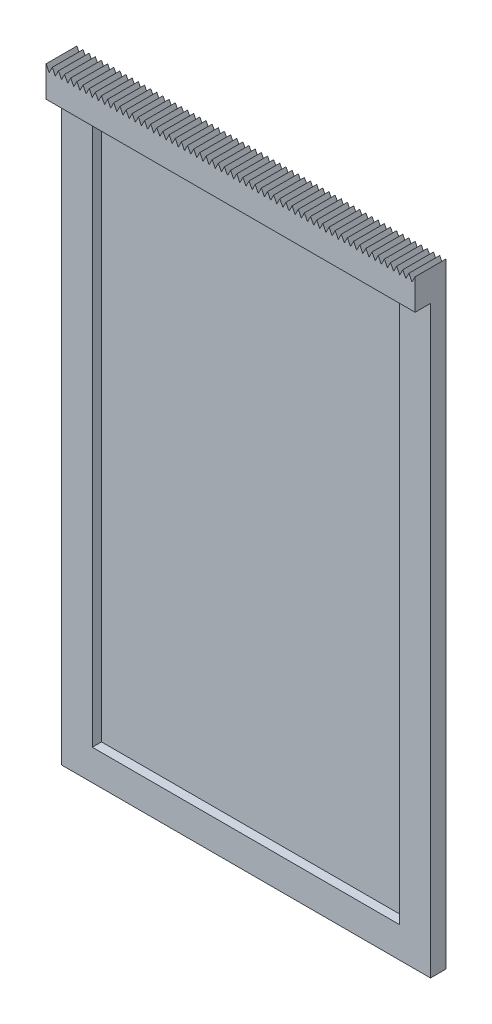
from build123d import *

# Parameters (mm, degrees)
CROQUIS2_W              = 120
CROQUIS2_H              = 200
SALIENTE_EXTRUIR1_DEPTH = 5
CROQUIS3_W              = 100
CROQUIS3_H              = 180
CORTAR_EXTRUIR1_DEPTH   = 3
CROQUIS4_W              = 120
CROQUIS4_H              = 10
SALIENTE_EXTRUIR3_DEPTH = 5
CORTAR_EXTRUIR2_DEPTH   = 10
CROQUIS6_W              = 5
CROQUIS6_H              = 10
SALIENTE_EXTRUIR4_DEPTH = 120
CORTAR_EXTRUIR3_DEPTH   = 10


with BuildPart() as part:
    # Croquis2 → Saliente-Extruir1 (new body)
    with BuildSketch(Plane.XY):
        Rectangle(CROQUIS2_W, CROQUIS2_H)
    extrude(amount=SALIENTE_EXTRUIR1_DEPTH)

    # Croquis3 → Cortar-Extruir1 (cut)
    with BuildSketch(Plane.XY.offset(5)):
        Rectangle(CROQUIS3_W, CROQUIS3_H)
    extrude(amount=-CORTAR_EXTRUIR1_DEPTH, mode=Mode.SUBTRACT)

    # Croquis4 → Saliente-Extruir3 (add)
    with BuildSketch(Plane.XY.offset(5)):
        with Locations((0, 95)):
            Rectangle(CROQUIS4_W, CROQUIS4_H)
    extrude(amount=SALIENTE_EXTRUIR3_DEPTH)

    # Croquis5 → Cortar-Extruir2 (cut)
    with BuildSketch(Plane(origin=(0, 100, 0), x_dir=(1, 0, 0), z_dir=(0, 1, 0))):
        Polygon((59, -8), (58, -10), (60, -10), align=None)
        Polygon((57, -8), (56, -10), (58, -10), align=None)
        Polygon((55, -8), (54, -10), (56, -10), align=None)
        Polygon((53, -8), (52, -10), (54, -10), align=None)
        Polygon((51, -8), (50, -10), (52, -10), align=None)
        Polygon((49, -8), (48, -10), (50, -10), align=None)
        Polygon((47, -8), (46, -10), (48, -10), align=None)
        Polygon((45, -8), (44, -10), (46, -10), align=None)
        Polygon((43, -8), (42, -10), (44, -10), align=None)
        Polygon((41, -8), (40, -10), (42, -10), align=None)
        Polygon((39, -8), (38, -10), (40, -10), align=None)
        Polygon((37, -8), (36, -10), (38, -10), align=None)
        Polygon((35, -8), (34, -10), (36, -10), align=None)
        Polygon((33, -8), (32, -10), (34, -10), align=None)
        Polygon((31, -8), (30, -10), (32, -10), align=None)
        Polygon((29, -8), (28, -10), (30, -10), align=None)
        Polygon((27, -8), (26, -10), (28, -10), align=None)
        Polygon((25, -8), (24, -10), (26, -10), align=None)
        Polygon((23, -8), (22, -10), (24, -10), align=None)
        Polygon((21, -8), (20, -10), (22, -10), align=None)
        Polygon((19, -8), (18, -10), (20, -10), align=None)
        Polygon((17, -8), (16, -10), (18, -10), align=None)
        Polygon((15, -8), (14, -10), (16, -10), align=None)
        Polygon((13, -8), (12, -10), (14, -10), align=None)
        Polygon((11, -8), (10, -10), (12, -10), align=None)
        Polygon((9, -8), (8, -10), (10, -10), align=None)
        Polygon((7, -8), (6, -10), (8, -10), align=None)
        Polygon((5, -8), (4, -10), (6, -10), align=None)
        Polygon((3, -8), (2, -10), (4, -10), align=None)
        Polygon((1, -8), (0, -10), (2, -10), align=None)
        Polygon((-1, -8), (-2, -10), (0, -10), align=None)
        Polygon((-3, -8), (-4, -10), (-2, -10), align=None)
        Polygon((-5, -8), (-6, -10), (-4, -10), align=None)
        Polygon((-7, -8), (-8, -10), (-6, -10), align=None)
        Polygon((-9, -8), (-10, -10), (-8, -10), align=None)
        Polygon((-11, -8), (-12, -10), (-10, -10), align=None)
        Polygon((-13, -8), (-14, -10), (-12, -10), align=None)
        Polygon((-15, -8), (-16, -10), (-14, -10), align=None)
        Polygon((-17, -8), (-18, -10), (-16, -10), align=None)
        Polygon((-19, -8), (-20, -10), (-18, -10), align=None)
        Polygon((-21, -8), (-22, -10), (-20, -10), align=None)
        Polygon((-23, -8), (-24, -10), (-22, -10), align=None)
        Polygon((-25, -8), (-26, -10), (-24, -10), align=None)
        Polygon((-27, -8), (-28, -10), (-26, -10), align=None)
        Polygon((-29, -8), (-30, -10), (-28, -10), align=None)
        Polygon((-31, -8), (-32, -10), (-30, -10), align=None)
        Polygon((-33, -8), (-34, -10), (-32, -10), align=None)
        Polygon((-35, -8), (-36, -10), (-34, -10), align=None)
        Polygon((-37, -8), (-38, -10), (-36, -10), align=None)
        Polygon((-39, -8), (-40, -10), (-38, -10), align=None)
        Polygon((-41, -8), (-42, -10), (-40, -10), align=None)
        Polygon((-43, -8), (-44, -10), (-42, -10), align=None)
        Polygon((-45, -8), (-46, -10), (-44, -10), align=None)
        Polygon((-47, -8), (-48, -10), (-46, -10), align=None)
        Polygon((-49, -8), (-50, -10), (-48, -10), align=None)
        Polygon((-51, -8), (-52, -10), (-50, -10), align=None)
        Polygon((-53, -8), (-54, -10), (-52, -10), align=None)
        Polygon((-55, -8), (-56, -10), (-54, -10), align=None)
        Polygon((-57, -8), (-58, -10), (-56, -10), align=None)
        Polygon((-59, -8), (-60, -10), (-58, -10), align=None)
    extrude(amount=-CORTAR_EXTRUIR2_DEPTH, mode=Mode.SUBTRACT)

    # Croquis6 → Saliente-Extruir4 (add)
    with BuildSketch(Plane.ZY.offset(60)):
        with Locations((7.5, 95)):
            Rectangle(CROQUIS6_W, CROQUIS6_H)
    extrude(amount=-SALIENTE_EXTRUIR4_DEPTH)

    # Croquis7 → Cortar-Extruir3 (cut)
    with BuildSketch(Plane.XY.offset(10)):
        Polygon((-58, 100), (-60, 100), (-59, 98), align=None)
        Polygon((60, 100), (58, 100), (59, 98), align=None)
        Polygon((58, 100), (56, 100), (57, 98), align=None)
        Polygon((56, 100), (54, 100), (55, 98), align=None)
        Polygon((54, 100), (52, 100), (53, 98), align=None)
        Polygon((52, 100), (50, 100), (51, 98), align=None)
        Polygon((50, 100), (48, 100), (49, 98), align=None)
        Polygon((48, 100), (46, 100), (47, 98), align=None)
        Polygon((46, 100), (44, 100), (45, 98), align=None)
        Polygon((44, 100), (42, 100), (43, 98), align=None)
        Polygon((42, 100), (40, 100), (41, 98), align=None)
        Polygon((40, 100), (38, 100), (39, 98), align=None)
        Polygon((38, 100), (36, 100), (37, 98), align=None)
        Polygon((36, 100), (34, 100), (35, 98), align=None)
        Polygon((34, 100), (32, 100), (33, 98), align=None)
        Polygon((32, 100), (30, 100), (31, 98), align=None)
        Polygon((30, 100), (28, 100), (29, 98), align=None)
        Polygon((28, 100), (26, 100), (27, 98), align=None)
        Polygon((26, 100), (24, 100), (25, 98), align=None)
        Polygon((24, 100), (22, 100), (23, 98), align=None)
        Polygon((22, 100), (20, 100), (21, 98), align=None)
        Polygon((20, 100), (18, 100), (19, 98), align=None)
        Polygon((18, 100), (16, 100), (17, 98), align=None)
        Polygon((16, 100), (14, 100), (15, 98), align=None)
        Polygon((14, 100), (12, 100), (13, 98), align=None)
        Polygon((12, 100), (10, 100), (11, 98), align=None)
        Polygon((10, 100), (8, 100), (9, 98), align=None)
        Polygon((8, 100), (6, 100), (7, 98), align=None)
        Polygon((6, 100), (4, 100), (5, 98), align=None)
        Polygon((4, 100), (2, 100), (3, 98), align=None)
        Polygon((2, 100), (0, 100), (1, 98), align=None)
        Polygon((0, 100), (-2, 100), (-1, 98), align=None)
        Polygon((-2, 100), (-4, 100), (-3, 98), align=None)
        Polygon((-4, 100), (-6, 100), (-5, 98), align=None)
        Polygon((-6, 100), (-8, 100), (-7, 98), align=None)
        Polygon((-8, 100), (-10, 100), (-9, 98), align=None)
        Polygon((-10, 100), (-12, 100), (-11, 98), align=None)
        Polygon((-12, 100), (-14, 100), (-13, 98), align=None)
        Polygon((-14, 100), (-16, 100), (-15, 98), align=None)
        Polygon((-16, 100), (-18, 100), (-17, 98), align=None)
        Polygon((-18, 100), (-20, 100), (-19, 98), align=None)
        Polygon((-20, 100), (-22, 100), (-21, 98), align=None)
        Polygon((-22, 100), (-24, 100), (-23, 98), align=None)
        Polygon((-24, 100), (-26, 100), (-25, 98), align=None)
        Polygon((-26, 100), (-28, 100), (-27, 98), align=None)
        Polygon((-28, 100), (-30, 100), (-29, 98), align=None)
        Polygon((-30, 100), (-32, 100), (-31, 98), align=None)
        Polygon((-32, 100), (-34, 100), (-33, 98), align=None)
        Polygon((-34, 100), (-36, 100), (-35, 98), align=None)
        Polygon((-36, 100), (-38, 100), (-37, 98), align=None)
        Polygon((-38, 100), (-40, 100), (-39, 98), align=None)
        Polygon((-40, 100), (-42, 100), (-41, 98), align=None)
        Polygon((-42, 100), (-44, 100), (-43, 98), align=None)
        Polygon((-44, 100), (-46, 100), (-45, 98), align=None)
        Polygon((-46, 100), (-48, 100), (-47, 98), align=None)
        Polygon((-48, 100), (-50, 100), (-49, 98), align=None)
        Polygon((-50, 100), (-52, 100), (-51, 98), align=None)
        Polygon((-52, 100), (-54, 100), (-53, 98), align=None)
        Polygon((-54, 100), (-56, 100), (-55, 98), align=None)
        Polygon((-56, 100), (-58, 100), (-57, 98), align=None)
    extrude(amount=-CORTAR_EXTRUIR3_DEPTH, mode=Mode.SUBTRACT)


solid = part.part
